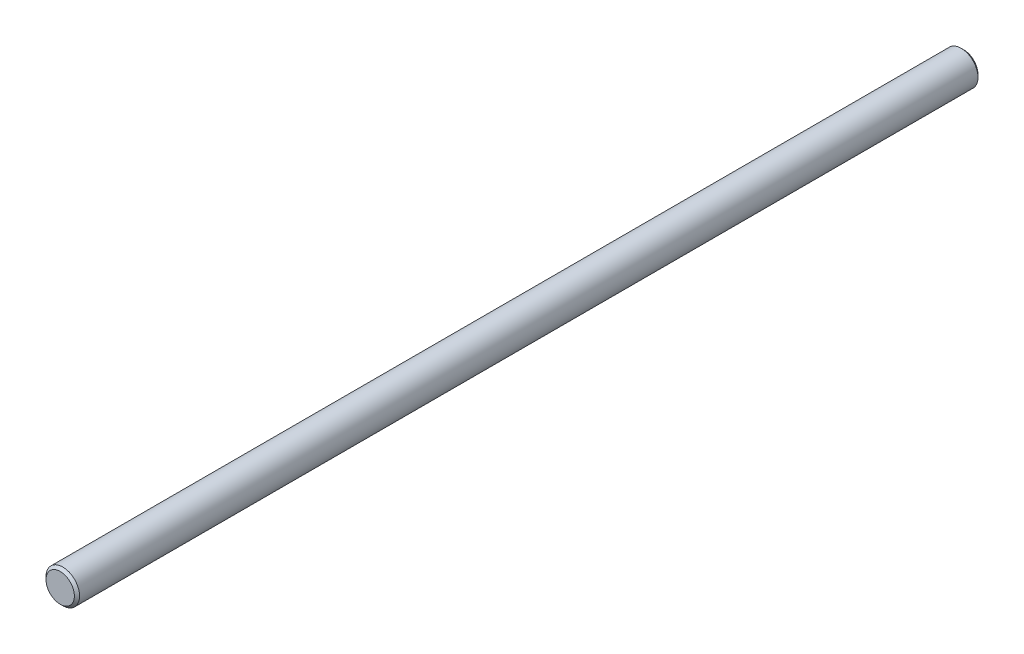
from build123d import *

# Parameters (mm, degrees)
SKETCH1_W     = 6.5
SKETCH1_H     = 350
CHAMFER1_SIZE = 1


with BuildPart() as part:
    # Sketch1 → Revolve1 (revolve)
    with BuildSketch(Plane(origin=(0, 0, 0), x_dir=(1, 0, 0), z_dir=(0, 1, 0))):
        with Locations((3.25, 175)):
            Rectangle(SKETCH1_W, SKETCH1_H)
    revolve(axis=Axis((0, 0, -350), (0, 0, 1)))

    # Chamfer1
    chamfer1_edges = [part.edges().sort_by_distance(p)[0] for p in [
        (-6.5, 0, 0),
        (-6.5, 0, -350),
    ]]
    chamfer(chamfer1_edges, length=CHAMFER1_SIZE)


solid = part.part
